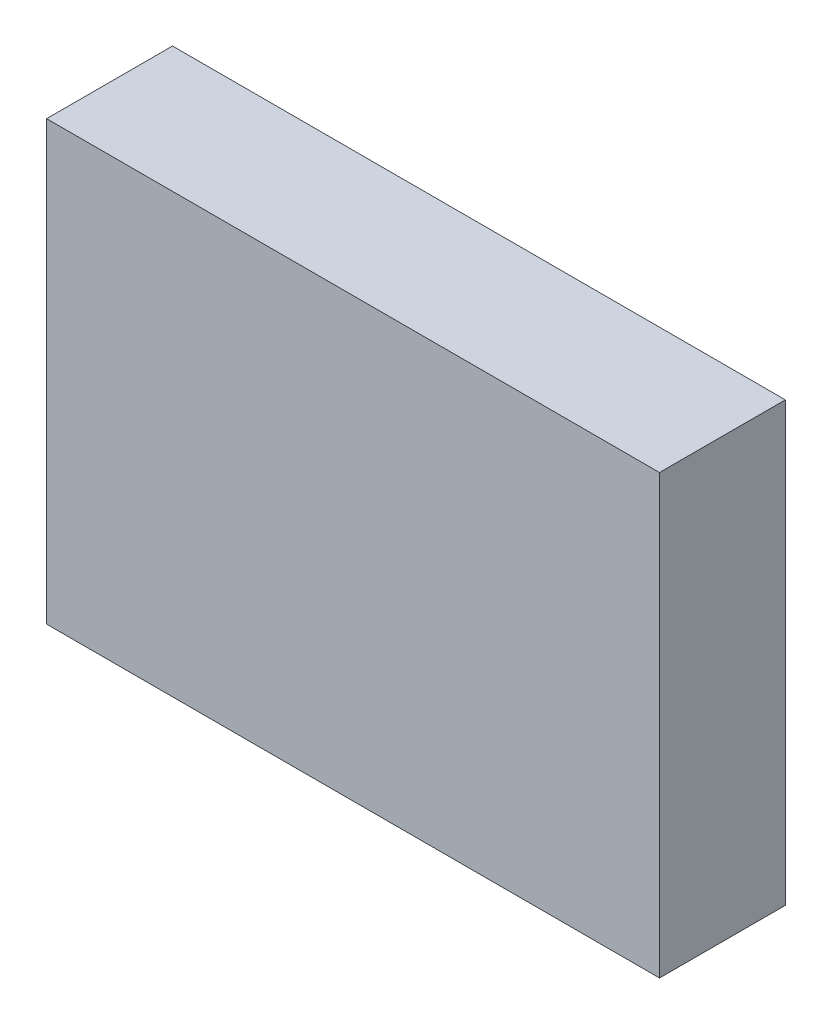
from build123d import *

# Parameters (mm, degrees)
SKETCH1_W           = 88.9
SKETCH1_H           = 63.5
BOSS_EXTRUDE1_DEPTH = 9.128125


with BuildPart() as part:
    # Sketch1 → Boss-Extrude1 (new, symmetric)
    with BuildSketch(Plane.XY):
        Rectangle(SKETCH1_W, SKETCH1_H)
    extrude(amount=BOSS_EXTRUDE1_DEPTH, both=True)


solid = part.part
